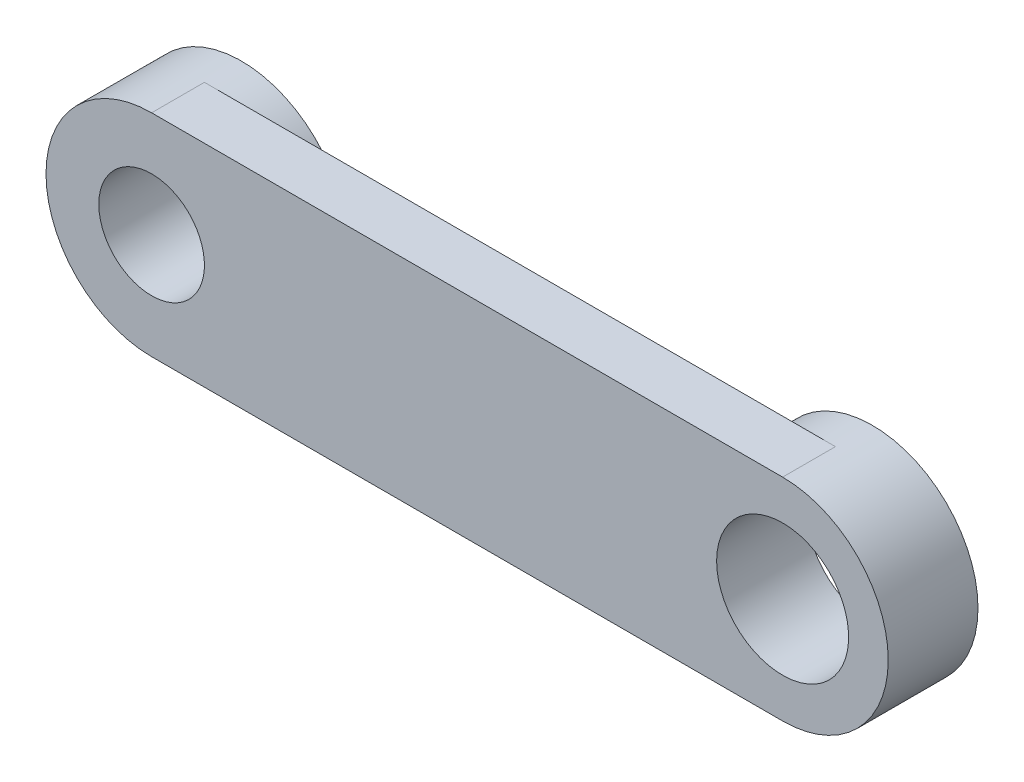
from build123d import *

# Parameters (mm, degrees)
SCHIZZO1_W                   = 119.5
SCHIZZO1_H                   = 40
ESTRUSIONE_ESTRUSIONE1_DEPTH = 10
SCHIZZO2_R                   = 20
ESTRUSIONE_ESTRUSIONE2_DEPTH = 17
SCHIZZO3_R                   = 12.5
SCHIZZO3_R_2                 = 10
TAGLIO_ESTRUSIONE1_DEPTH     = 84.958695202


with BuildPart() as part:
    # Schizzo1 → Estrusione-Estrusione1 (new body)
    with BuildSketch(Plane.XY):
        Rectangle(SCHIZZO1_W, SCHIZZO1_H)
    extrude(amount=ESTRUSIONE_ESTRUSIONE1_DEPTH)

    # Schizzo2 → Estrusione-Estrusione2 (add)
    with BuildSketch(Plane.XY.offset(10)):
        with Locations((-59.75, 0)):
            Circle(SCHIZZO2_R)
        with Locations((59.75, 0)):
            Circle(SCHIZZO2_R)
    extrude(amount=-ESTRUSIONE_ESTRUSIONE2_DEPTH)

    # Schizzo3 → Taglio-Estrusione1 (cut, through all)
    with BuildSketch(Plane(origin=(0, 0, -7), x_dir=(-1, 0, 0), z_dir=(0, 0, -1))):
        with Locations((-59.75, 0)):
            Circle(SCHIZZO3_R)
        with Locations((59.75, 0)):
            Circle(SCHIZZO3_R_2)
    extrude(amount=-TAGLIO_ESTRUSIONE1_DEPTH, mode=Mode.SUBTRACT)


solid = part.part
